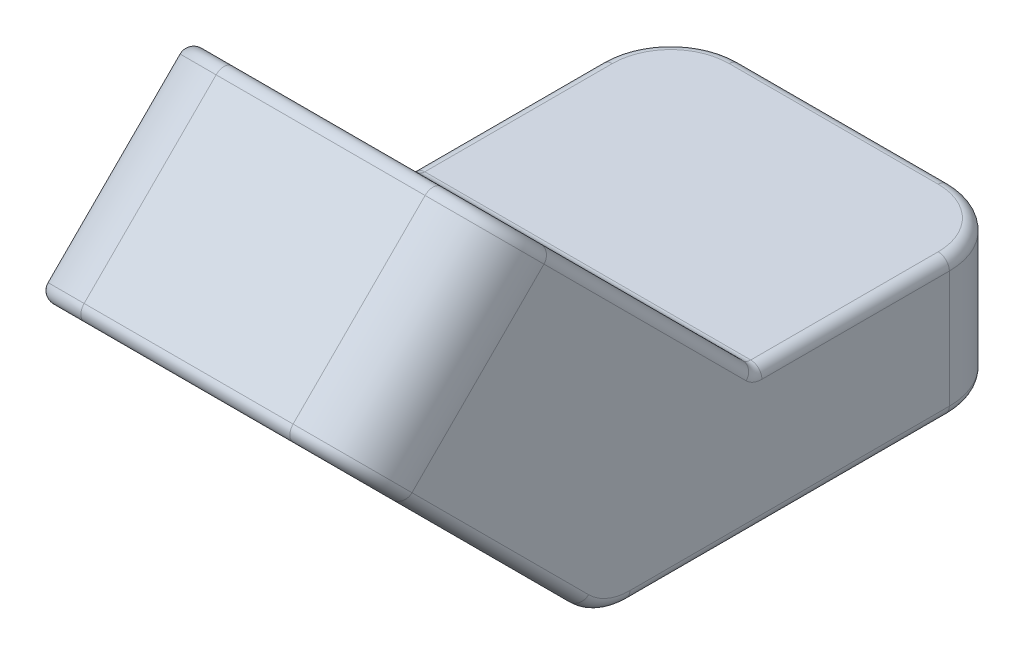
from build123d import *

# Parameters (mm, degrees)
BOSS_EXTRUDE1_DEPTH = 15.875
SKETCH2_R           = 3.302
CUT_EXTRUDE1_DEPTH  = 38.921561078
CHAMFER1_SIZE       = 3.175
CHAMFER1_SIZE2      = 3.652419693
FILLET1_R           = 3.175
FILLET2_R           = 0.508


with BuildPart() as part:
    # Sketch1 → Boss-Extrude1 (new body)
    with BuildSketch(Plane(origin=(0, 0, 0), x_dir=(0, 0, -1), z_dir=(1, 0, 0))):
        Polygon((0, 0), (-19.05, 0), (-30.275320151, 11.225320151), (-23.540128061, 17.960512242), (-11.929615818, 6.35), (0, 6.35), align=None)
    extrude(amount=BOSS_EXTRUDE1_DEPTH)

    # Sketch2 → Cut-Extrude1 (cut, through all)
    with BuildSketch(Plane(origin=(0, -2.789807909, 2.789807909), x_dir=(1, 0, 0), z_dir=(0, 0.7071067811865465, -0.7071067811865486))):
        with Locations(Location((7.9375, -20.291640303, 0), (0, 0, 270))):
            Circle(SKETCH2_R)
    extrude(amount=-CUT_EXTRUDE1_DEPTH, mode=Mode.SUBTRACT)

    # Chamfer1
    chamfer1_edges = [part.edges().sort_by_distance(p)[0] for p in [
        (7.9375, 9.223681959, 14.803297777),
    ]]
    chamfer1_side = [part.faces().sort_by_distance(p)[0] for p in [
        (7.9375, 17.799015553, 23.378631371),
    ]]
    chamfer(chamfer1_edges, length=CHAMFER1_SIZE, length2=CHAMFER1_SIZE2, reference=chamfer1_side[0])

    # Fillet1
    fillet1_edges = [part.edges().sort_by_distance(p)[0] for p in [
        (7.9375, 0, 19.05),
        (15.875, 14.592916197, 26.907724106),
        (15.875, 3.175, 0),
        (0, 14.592916197, 26.907724106),
        (0, 3.175, 0),
    ]]
    fillet(fillet1_edges, radius=FILLET1_R)

    # Fillet2
    fillet2_edges = [part.edges().sort_by_distance(p)[0] for p in [
        (7.9375, 6.35, 11.929615818),
        (15.875, 11.032724106, 16.612339924),
        (7.9375, 6.35, 0),
        (7.9375, 0, 0),
        (0, 6.35, 7.552307909),
        (15.875, 6.35, 7.552307909),
        (14.94506403, 6.35, 0.92993597),
        (0.92993597, 6.35, 0.92993597),
        (0, 0, 10.45493597),
        (0, 4.955096045, 24.005096045),
        (0, 0.241682484, 18.949891837),
        (15.875, 0, 10.45493597),
        (14.94506403, 0, 0.92993597),
        (0.92993597, 0, 0.92993597),
        (15.875, 4.955096045, 24.005096045),
        (15.875, 0.241682484, 18.949891837),
        (7.9375, 11.225320151, 30.275320151),
        (7.9375, 17.960512242, 23.540128061),
        (14.94506403, 10.567756121, 29.617756121),
        (0.92993597, 10.567756121, 29.617756121),
        (14.94506403, 17.302948212, 22.88256403),
        (0.92993597, 17.302948212, 22.88256403),
        (0, 11.032724106, 16.612339924),
    ]]
    fillet(fillet2_edges, radius=FILLET2_R)


solid = part.part
